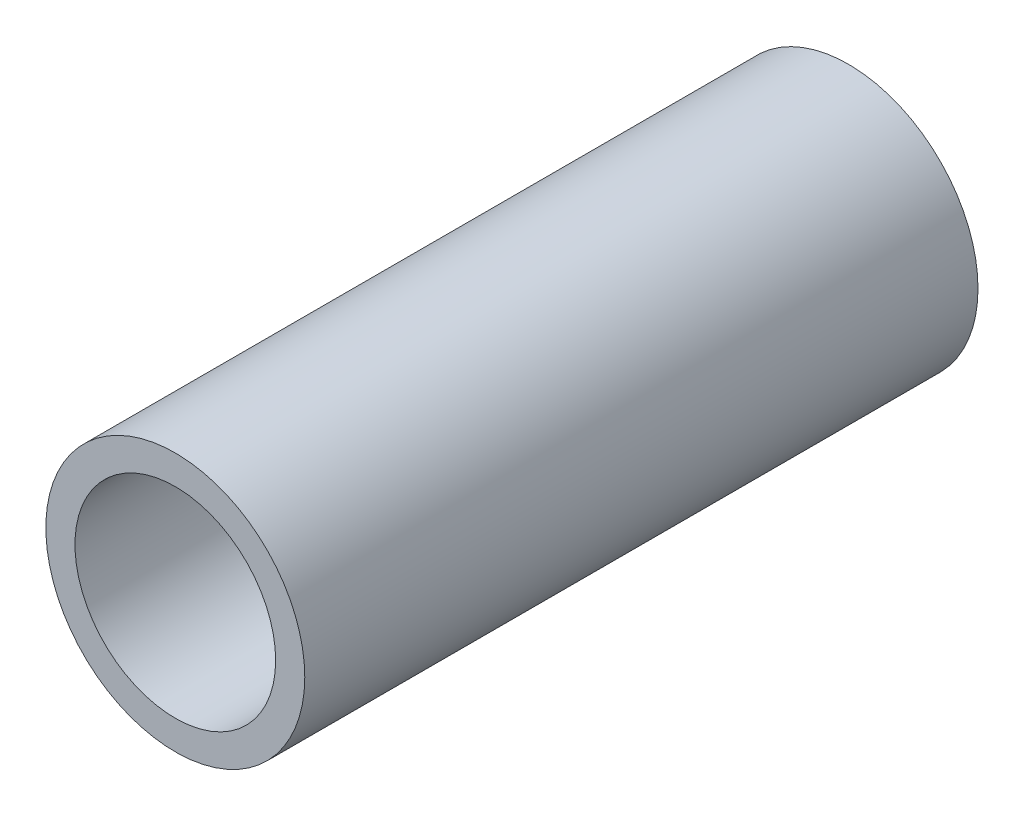
from build123d import *

# Parameters (mm, degrees)
SKETCH_1_R      = 1
SKETCH_1_R_2    = 0.775
EXTRUDE_1_DEPTH = 5.2


with BuildPart() as part:
    # Эскиз1 → Бобышка-Вытянуть1 (new body)
    with BuildSketch(Plane.XY):
        Circle(SKETCH_1_R)
        Circle(SKETCH_1_R_2, mode=Mode.SUBTRACT)
    extrude(amount=EXTRUDE_1_DEPTH)


solid = part.part
